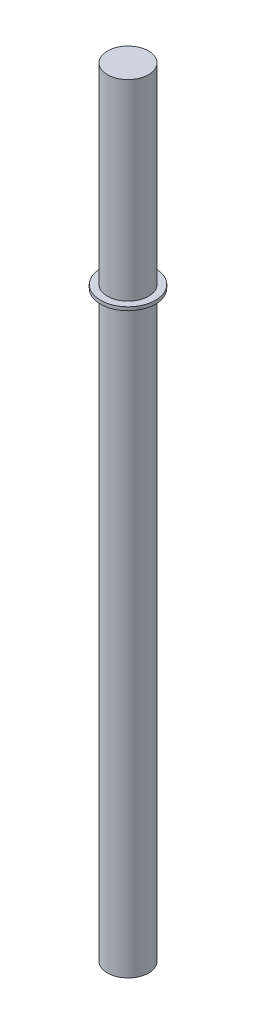
from build123d import *

# Parameters (mm, degrees)
SKETCH1_R           = 3
BOSS_EXTRUDE1_DEPTH = 28
SKETCH2_R           = 4
BOSS_EXTRUDE2_DEPTH = 0.5
BOSS_EXTRUDE3_START = 85
SKETCH3_R           = 3
BOSS_EXTRUDE3_DEPTH = 85


with BuildPart() as part:
    # Sketch1 → Boss-Extrude1 (new body)
    with BuildSketch(Plane(origin=(0, 0, 0), x_dir=(1, 0, 0), z_dir=(0, 1, 0))):
        with Locations(Location((0, 0, 0), (0, 0, 270))):
            Circle(SKETCH1_R)
    extrude(amount=BOSS_EXTRUDE1_DEPTH)

    # Sketch2 → Boss-Extrude2 (add)
    with BuildSketch(Plane.XZ):
        with Locations(Location((0, 0, 0), (0, 0, 270))):
            Circle(SKETCH2_R)
    extrude(amount=BOSS_EXTRUDE2_DEPTH)

    # Sketch3 → Boss-Extrude3 (add)
    with BuildSketch(Plane.XZ.offset(0.5).offset(BOSS_EXTRUDE3_START)):
        with Locations(Location((0, 0, 0), (0, 0, 90))):
            Circle(SKETCH3_R)
    extrude(amount=-BOSS_EXTRUDE3_DEPTH)


solid = part.part
